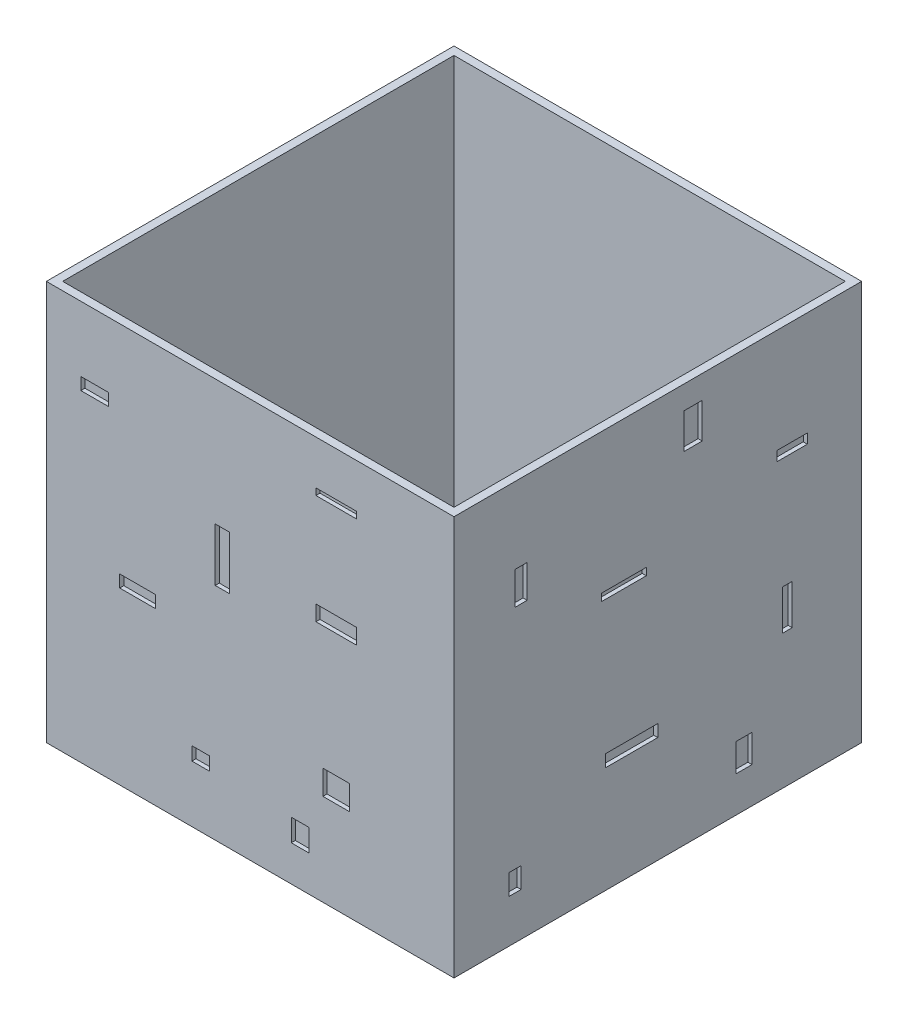
from build123d import *

# Parameters (mm, degrees)
IZIM1_W                     = 100
IZIM1_H                     = 100
IZIM1_R                     = 24.5
Y_KSEKLIK_EKSTR_ZYON1_DEPTH = 2
IZIM2_W                     = 100
IZIM2_H                     = 100
IZIM2_W_2                   = 96
IZIM2_H_2                   = 96
Y_KSEKLIK_EKSTR_ZYON2_DEPTH = 96
IZIM3_W                     = 6.808697121
IZIM3_H                     = 2.995826734
IZIM3_W_2                   = 3.540522504
IZIM3_H_2                   = 13.072698474
IZIM3_W_3                   = 8.715132316
IZIM3_W_4                   = 9.959144329
IZIM3_H_3                   = 3.786659795
IZIM3_W_5                   = 6.536349237
IZIM3_H_4                   = 5.991653467
IZIM3_W_6                   = 4.357566158
IZIM3_H_5                   = 3.268174619
IZIM3_H_6                   = 5.446957697
IZIM3_H_7                   = 1.63408731
KES_EKSTR_ZYON1_DEPTH       = 1
IZIM4_W                     = 2.855123206
IZIM4_H                     = 4.861170012
IZIM4_W_2                   = 11.319008014
IZIM4_H_2                   = 1.730473094
IZIM4_W_3                   = 2.714479197
IZIM4_H_3                   = 10.322809225
IZIM4_W_4                   = 9.387113738
IZIM4_H_4                   = 3.377434488
IZIM4_W_5                   = 4.989274294
IZIM4_H_5                   = 13.829779239
IZIM4_W_6                   = 7.288706005
IZIM4_H_6                   = 5.901605045
IZIM4_W_7                   = 5.357045211
IZIM4_H_7                   = 5.315156672
IZIM4_W_8                   = 2.340389822
IZIM4_H_8                   = 9.060236987
KES_EKSTR_ZYON2_DEPTH       = 1
IZIM5_W                     = 2.995826734
IZIM5_H                     = 4.357566158
IZIM5_W_2                   = 11.16626328
IZIM5_H_2                   = 1.634087309
IZIM5_W_3                   = 2.995826733
IZIM5_H_3                   = 7.625740777
IZIM5_W_4                   = 7.353392891
IZIM5_W_5                   = 3.812870388
IZIM5_H_4                   = 8.442784431
IZIM5_W_6                   = 8.987480201
IZIM5_H_5                   = 2.451130964
IZIM5_W_7                   = 3.268174618
IZIM5_H_6                   = 6.264001352
KES_EKSTR_ZYON3_DEPTH       = 1
IZIM6_W                     = 2.982026027
IZIM6_H                     = 8.051470273
IZIM6_W_2                   = 11.033496299
IZIM6_H_2                   = 1.789215616
IZIM6_W_3                   = 2.385620822
IZIM6_H_3                   = 9.840685888
IZIM6_W_4                   = 7.455065067
IZIM6_H_4                   = 2.385620821
IZIM6_W_5                   = 12.822711915
IZIM6_H_5                   = 2.982026027
IZIM6_H_6                   = 5.069444246
IZIM6_W_6                   = 3.876633835
IZIM6_H_7                   = 6.858659862
IZIM6_W_7                   = 4.473039041
IZIM6_H_8                   = 8.647875478
KES_EKSTR_ZYON4_DEPTH       = 1


with BuildPart() as part:
    # Çizim1 → Yükseklik-Ekstrüzyon1 (new body)
    with BuildSketch(Plane(origin=(0, 0, 0), x_dir=(1, 0, 0), z_dir=(0, 1, 0))):
        Rectangle(IZIM1_W, IZIM1_H)
        with Locations(Location((0, 0, 0), (0, 0, 270))):
            Circle(IZIM1_R, mode=Mode.SUBTRACT)
    extrude(amount=Y_KSEKLIK_EKSTR_ZYON1_DEPTH)

    # Çizim2 → Yükseklik-Ekstrüzyon2 (add)
    with BuildSketch(Plane(origin=(0, 2, 0), x_dir=(1, 0, 0), z_dir=(0, 1, 0))):
        Rectangle(IZIM2_W, IZIM2_H)
        Rectangle(IZIM2_W_2, IZIM2_H_2, mode=Mode.SUBTRACT)
    extrude(amount=Y_KSEKLIK_EKSTR_ZYON2_DEPTH)

    # Çizim3 → Kes-Ekstrüzyon1 (cut)
    with BuildSketch(Plane.XY.offset(50)):
        with Locations((-38.128703883, 80.524267674)):
            Rectangle(IZIM3_W, IZIM3_H)
        with Locations((-6.808697122, 60.642872078)):
            Rectangle(IZIM3_W_2, IZIM3_H_2)
        with Locations((-27.643310315, 43.348781389)):
            Rectangle(IZIM3_W_3, IZIM3_H)
        with Locations((21.106961078, 60.642872079)):
            Rectangle(IZIM3_W_4, IZIM3_H_3)
        with Locations((21.106961078, 25.50999493)):
            Rectangle(IZIM3_W_5, IZIM3_H_4)
        with Locations((-12.119480877, 15.569297132)):
            Rectangle(IZIM3_W_6, IZIM3_H_5)
        with Locations((12.255654819, 11.484078859)):
            Rectangle(IZIM3_W_6, IZIM3_H_6)
        with Locations((21.106961078, 86.379747199)):
            Rectangle(IZIM3_W_4, IZIM3_H_7)
    extrude(amount=-KES_EKSTR_ZYON1_DEPTH, mode=Mode.SUBTRACT)

    # Çizim4 → Kes-Ekstrüzyon2 (cut)
    with BuildSketch(Plane.ZY.offset(50)):
        with Locations((-40.12319253, 84.166167132)):
            Rectangle(IZIM4_W, IZIM4_H)
        with Locations((0, 48.061123669)):
            Rectangle(IZIM4_W_2, IZIM4_H_2)
        with Locations((12.386939179, 68.745292742)):
            Rectangle(IZIM4_W_3, IZIM4_H_3)
        with Locations((26.279902445, 54.531767203)):
            Rectangle(IZIM4_W_4, IZIM4_H_4)
        with Locations((-26.801088585, 31.592223885)):
            Rectangle(IZIM4_W_5, IZIM4_H_5)
        with Locations((7.385346578, 16.750764677)):
            Rectangle(IZIM4_W_6, IZIM4_H_6)
        with Locations((30.973459314, 18.564160483)):
            Rectangle(IZIM4_W_7, IZIM4_H_7)
        with Locations((-17.619740697, 72.897531843)):
            Rectangle(IZIM4_W_8, IZIM4_H_8)
    extrude(amount=-KES_EKSTR_ZYON2_DEPTH, mode=Mode.SUBTRACT)

    # Çizim5 → Kes-Ekstrüzyon3 (cut)
    with BuildSketch(Plane(origin=(0, 0, -50), x_dir=(-1, 0, 0), z_dir=(0, 0, -1))):
        with Locations((-29.822093394, 73.443222668)):
            Rectangle(IZIM5_W, IZIM5_H)
        with Locations((-6.944871064, 67.179221316)):
            Rectangle(IZIM5_W_2, IZIM5_H_2)
        with Locations((25.056005409, 45.799912353)):
            Rectangle(IZIM5_W_3, IZIM5_H_3)
        with Locations((6.12782741, 31.773996282)):
            Rectangle(IZIM5_W_4, IZIM5_H)
        with Locations((-28.324180027, 21.969472427)):
            Rectangle(IZIM5_W_5, IZIM5_H_4)
        with Locations((25.056005408, 16.250166844)):
            Rectangle(IZIM5_W_6, IZIM5_H_5)
        with Locations((18.928177999, 78.754006423)):
            Rectangle(IZIM5_W_7, IZIM5_H_6)
    extrude(amount=-KES_EKSTR_ZYON3_DEPTH, mode=Mode.SUBTRACT)

    # Çizim6 → Kes-Ekstrüzyon4 (cut)
    with BuildSketch(Plane(origin=(50, 0, 0), x_dir=(0, 0, -1), z_dir=(1, 0, 0))):
        with Locations((-33.547792801, 75.286818133)):
            Rectangle(IZIM6_W, IZIM6_H)
        with Locations((-8.349672875, 62.76230882)):
            Rectangle(IZIM6_W_2, IZIM6_H_2)
        with Locations((31.758577185, 37.862391497)):
            Rectangle(IZIM6_W_3, IZIM6_H_3)
        with Locations((32.951387596, 71.261082997)):
            Rectangle(IZIM6_W_4, IZIM6_H_4)
        with Locations((-6.411355958, 27.574401705)):
            Rectangle(IZIM6_W_5, IZIM6_H_5)
        with Locations((-35.038805815, 13.111575475)):
            Rectangle(IZIM6_W, IZIM6_H_6)
        with Locations((21.17238479, 12.216967667)):
            Rectangle(IZIM6_W_6, IZIM6_H_7)
        with Locations((8.647875478, 87.960428746)):
            Rectangle(IZIM6_W_7, IZIM6_H_8)
    extrude(amount=-KES_EKSTR_ZYON4_DEPTH, mode=Mode.SUBTRACT)


solid = part.part
